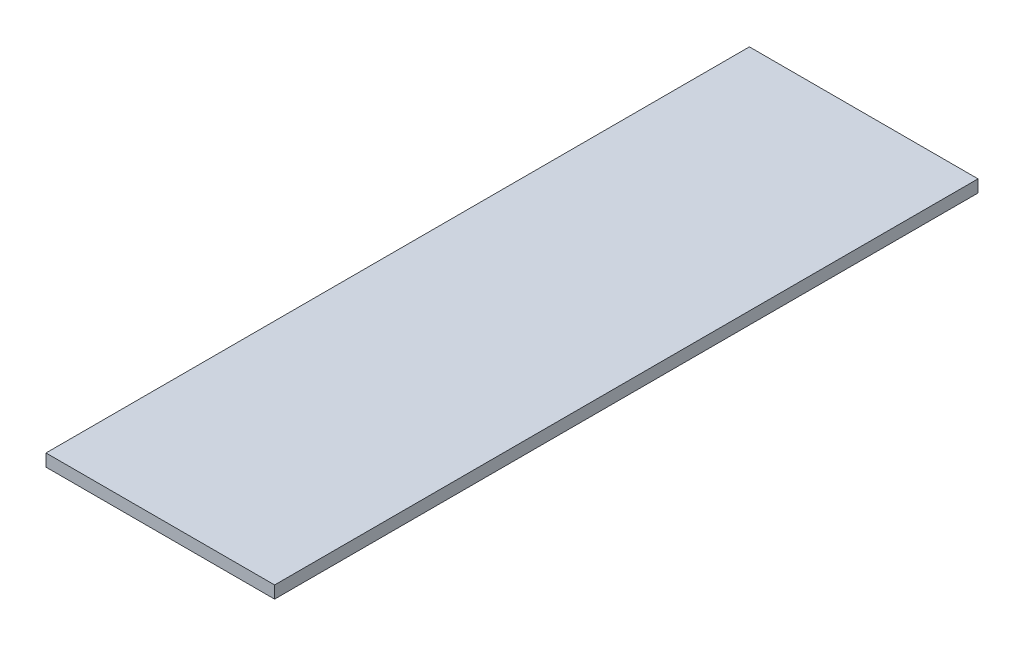
from build123d import *

# Parameters (mm, degrees)
SKETCH1_W           = 13
SKETCH1_H           = 40
BOSS_EXTRUDE1_DEPTH = 0.7


with BuildPart() as part:
    # Sketch1 → Boss-Extrude1 (new body)
    with BuildSketch(Plane(origin=(0, 0, 0), x_dir=(1, 0, 0), z_dir=(0, 1, 0))):
        Rectangle(SKETCH1_W, SKETCH1_H)
    extrude(amount=BOSS_EXTRUDE1_DEPTH)


solid = part.part
